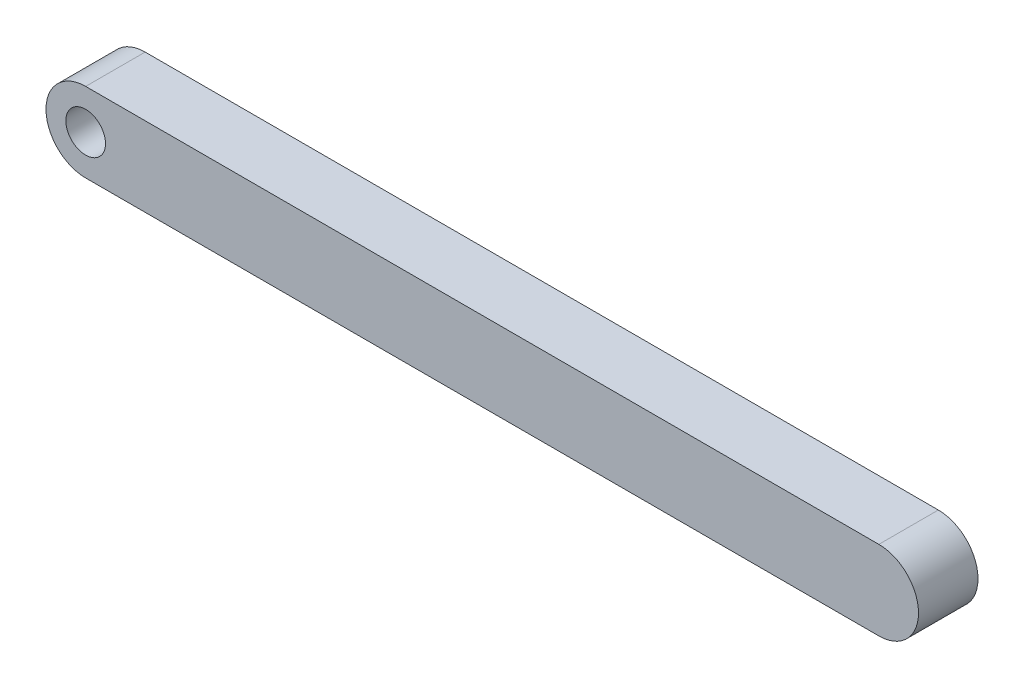
from build123d import *

# Parameters (mm, degrees)
SKETCH_1_R      = 1
EXTRUDE_1_DEPTH = 1.5


with BuildPart() as part:
    # 草图1 → 凸台-拉伸1 (new, symmetric)
    with BuildSketch(Plane.XY):
        with BuildLine():
            Line((0, 2), (40, 2))
            ThreePointArc((40, 2), (42, 0), (40, -2))
            Line((40, -2), (0, -2))
            ThreePointArc((0, -2), (-2, 0), (0, 2))
        make_face()
        Circle(SKETCH_1_R, mode=Mode.SUBTRACT)
    extrude(amount=EXTRUDE_1_DEPTH, both=True)


solid = part.part
